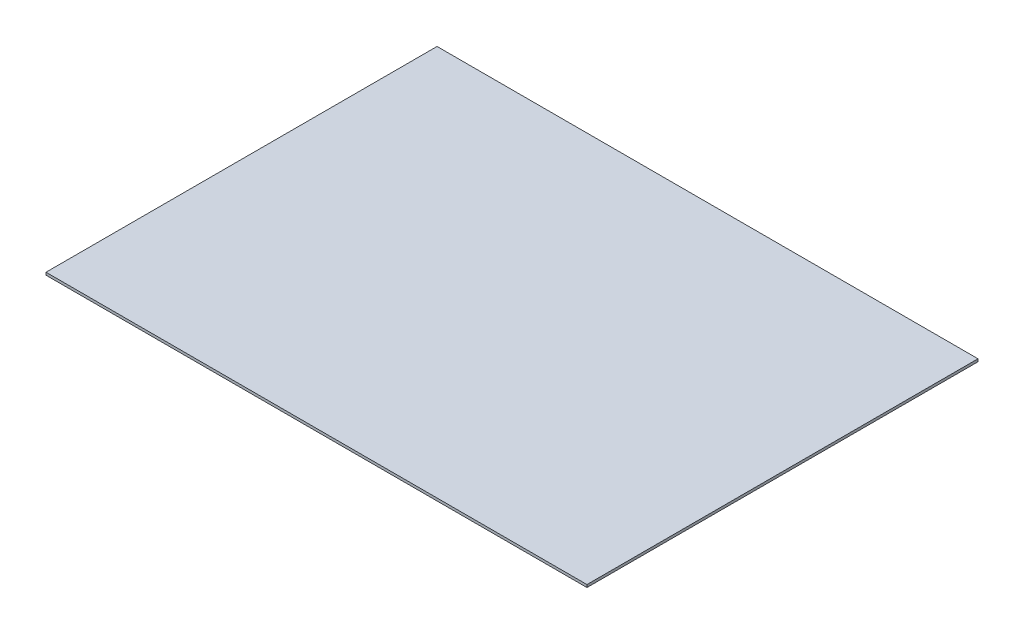
from build123d import *

# Parameters (mm, degrees)
SKETCH3_W           = 415
SKETCH3_H           = 300
BOSS_EXTRUDE1_DEPTH = 2
SKETCH4_W           = 385
SKETCH4_H           = 270
SKETCH4_W_2         = 375
SKETCH4_H_2         = 260
BOSS_EXTRUDE2_DEPTH = 10


with BuildPart() as part:
    # Sketch3 → Boss-Extrude1 (new body)
    with BuildSketch(Plane(origin=(0, 0, 0), x_dir=(1, 0, 0), z_dir=(0, 1, 0))):
        with Locations((2.465722121, -14.195612431)):
            Rectangle(SKETCH3_W, SKETCH3_H)
    extrude(amount=BOSS_EXTRUDE1_DEPTH)

    # Sketch4 → Boss-Extrude2 (add)
    with BuildSketch(Plane(origin=(0, 2, 0), x_dir=(1, 0, 0), z_dir=(0, 1, 0))):
        with Locations((2.465722121, -14.195612431)):
            Rectangle(SKETCH4_W, SKETCH4_H)
        with Locations((2.465722121, -14.195612431)):
            Rectangle(SKETCH4_W_2, SKETCH4_H_2, mode=Mode.SUBTRACT)
    extrude(amount=-BOSS_EXTRUDE2_DEPTH)


solid = part.part
